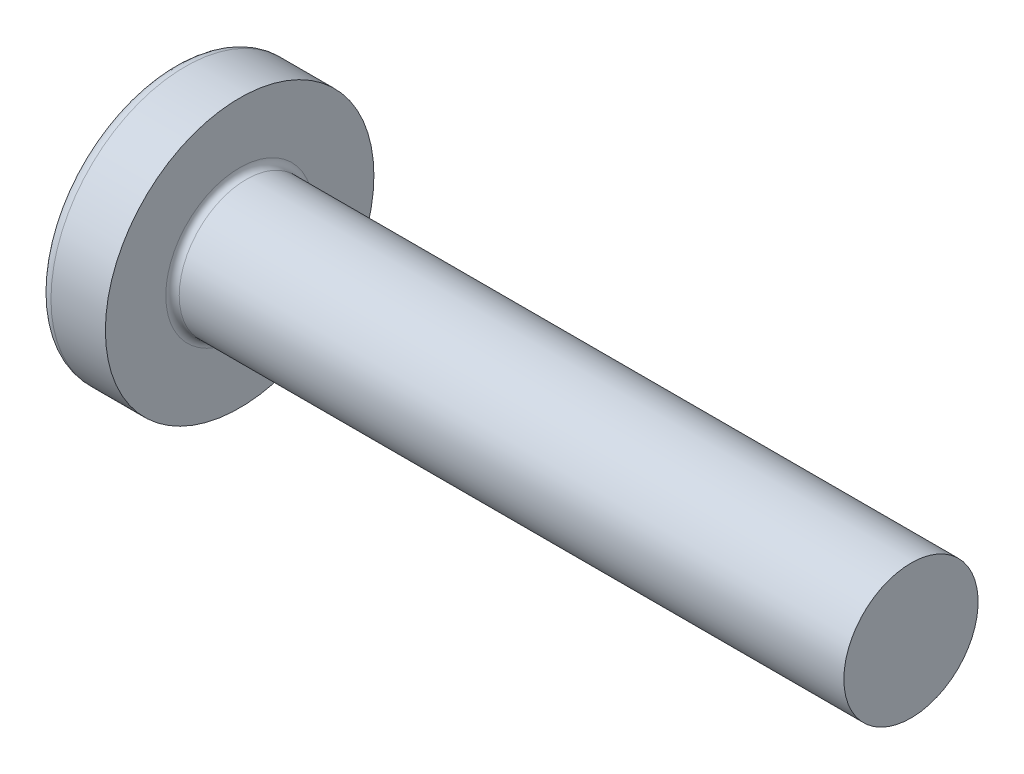
from build123d import *

# Parameters (mm, degrees)
FILLET1_R    = 0.1
RECPAT_COUNT = 2
RECPAT_ANGLE = 90


with BuildPart() as part:
    # BodySke → Base-Revolve (revolve)
    with BuildSketch(Plane.XY, mode=Mode.PRIVATE) as base_revolve_sk:
        with BuildLine():
            Line((1.6, 1), (1.6, 2))
            Line((1.6, 2), (0.790020747, 2))
            ThreePointArc((0.790020747, 2), (0.709789294, 1.981130115), (0.646379599, 1.928476821))
            ThreePointArc((0.646379599, 1.928476821), (0.165895084, 1.016959861), (0, 0))
            Line((0, 0), (11.6, 0))
            Line((11.6, 0), (11.6, 1))
            Line((11.6, 1), (1.6, 1))
        make_face()
    revolve(base_revolve_sk.sketch.rotate(Axis((0.790020747, 0, 0), (1, 0, 0)), 90), axis=Axis((0.790020747, 0, 0), (1, 0, 0)))

    # Fillet1
    fillet1_edges = [part.edges().sort_by_distance(p)[0] for p in [
        (1.6, 0, -1),
    ]]
    fillet(fillet1_edges, radius=FILLET1_R)

    # Sketch3 → Recess section 0
    with BuildSketch(Plane(origin=(0, 0, 0), x_dir=(0, 0, -1), z_dir=(1, 0, 0))):
        with BuildLine():
            Line((0.24, -1.05), (-0.24, -1.05))
            Line((-0.24, -1.05), (-0.24, 1.05))
            Line((-0.24, 1.05), (0.24, 1.05))
            Line((0.24, 1.05), (0.24, -1.05))
        make_face()
    # Sketch4 → Recess section 1
    with BuildSketch(Plane(origin=(1.42, 0, 0), x_dir=(0, 0, -1), z_dir=(1, 0, 0))):
        with BuildLine():
            Line((0.24, -0.342014235), (-0.24, -0.342014235))
            Line((-0.24, -0.342014235), (-0.24, 0.342014235))
            Line((-0.24, 0.342014235), (0.24, 0.342014235))
            Line((0.24, 0.342014235), (0.24, -0.342014235))
        make_face()
    recess = loft(mode=Mode.SUBTRACT)

    # RecPat: Recess ×2 about axis
    recpat_axis = Axis((0, 0, 0), (1, 0, 0))
    for i in range(1, RECPAT_COUNT):
        add(recess.rotate(recpat_axis, i * RECPAT_ANGLE / (RECPAT_COUNT - 1)), mode=Mode.SUBTRACT)

    # RecCorSke → RecessCore (revolve, cut)
    with BuildSketch(Plane.XY, mode=Mode.PRIVATE) as recesscore_sk:
        Polygon((0, 0), (0, 0.454796073), (1.42, 0.3555), (1.535508952, 0), align=None)
    revolve(recesscore_sk.sketch.rotate(Axis((-3.175, 0, 0), (1, 0, 0)), 13.894577695), axis=Axis((-3.175, 0, 0), (1, 0, 0)), mode=Mode.SUBTRACT)


solid = part.part
